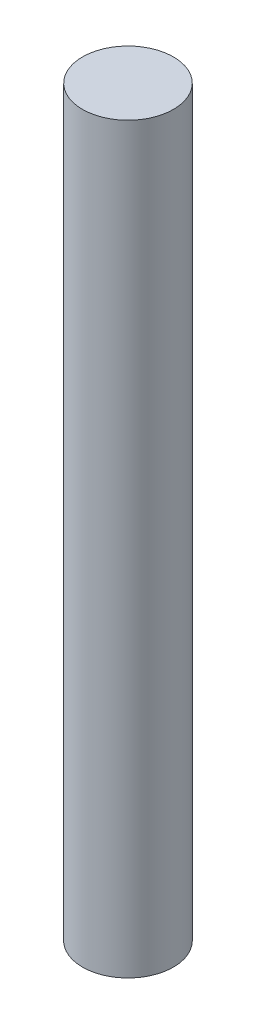
from build123d import *

# Parameters (mm, degrees)
SKETCH_1_R      = 0.6
EXTRUDE_1_DEPTH = 9.8


with BuildPart() as part:
    # 草图1 → 凸台-拉伸1 (new body)
    with BuildSketch(Plane(origin=(0, 0, 0), x_dir=(1, 0, 0), z_dir=(0, 1, 0))):
        with Locations(Location((0, 0, 0), (0, 0, 270))):
            Circle(SKETCH_1_R)
    extrude(amount=EXTRUDE_1_DEPTH)


solid = part.part
